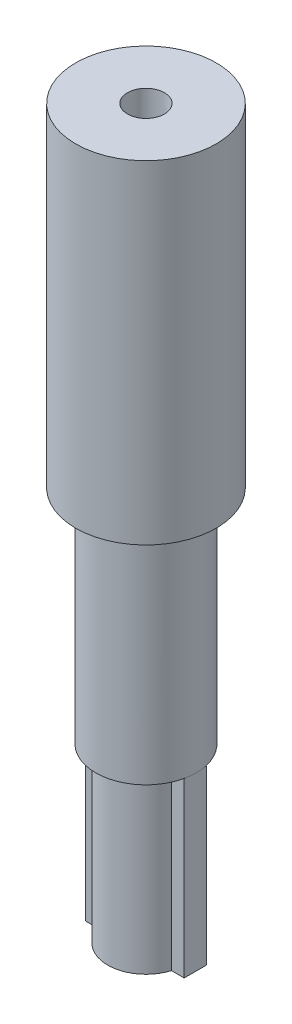
from build123d import *

# Parameters (mm, degrees)
SKETCH1_R           = 3.1
SKETCH1_W           = 8
SKETCH1_H           = 1.8
BOSS_EXTRUDE1_DEPTH = 14
SKETCH2_R           = 4.075
BOSS_EXTRUDE2_DEPTH = 18
SKETCH3_R           = 5.7
BOSS_EXTRUDE3_DEPTH = 2
SKETCH4_R           = 5.7
BOSS_EXTRUDE4_DEPTH = 25
SKETCH5_R           = 1.5
CUT_EXTRUDE1_DEPTH  = 17


with BuildPart() as part:
    # Sketch1 → Boss-Extrude1 (new body)
    with BuildSketch(Plane(origin=(0, 0, 0), x_dir=(1, 0, 0), z_dir=(0, 1, 0))):
        Circle(SKETCH1_R)
        Rectangle(SKETCH1_W, SKETCH1_H)
    extrude(amount=BOSS_EXTRUDE1_DEPTH)

    # Sketch2 → Boss-Extrude2 (add)
    with BuildSketch(Plane(origin=(0, 14, 0), x_dir=(1, 0, 0), z_dir=(0, 1, 0))):
        with Locations(Location((0, 0, 0), (0, 0, 12.759485069))):
            Circle(SKETCH2_R)
    extrude(amount=BOSS_EXTRUDE2_DEPTH)

    # Sketch3 → Boss-Extrude3 (add)
    with BuildSketch(Plane(origin=(0, 32, 0), x_dir=(1, 0, 0), z_dir=(0, 1, 0))):
        with Locations(Location((0, 0, 0), (0, 0, 270))):
            Circle(SKETCH3_R)
    extrude(amount=BOSS_EXTRUDE3_DEPTH)

    # Sketch4 → Boss-Extrude4 (add)
    with BuildSketch(Plane(origin=(0, 34, 0), x_dir=(1, 0, 0), z_dir=(0, 1, 0))):
        with Locations(Location((0, 0, 0), (0, 0, 270))):
            Circle(SKETCH4_R)
    extrude(amount=BOSS_EXTRUDE4_DEPTH)

    # Sketch5 → Cut-Extrude1 (cut)
    with BuildSketch(Plane(origin=(0, 59, 0), x_dir=(1, 0, 0), z_dir=(0, 1, 0))):
        with Locations(Location((0, 0, 0), (0, 0, 270))):
            Circle(SKETCH5_R)
    extrude(amount=-CUT_EXTRUDE1_DEPTH, mode=Mode.SUBTRACT)


solid = part.part
